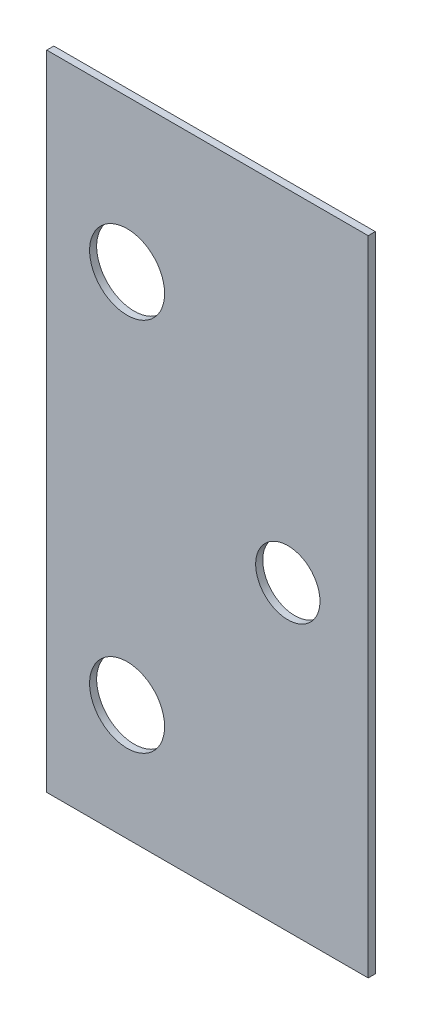
from build123d import *

# Parameters (mm, degrees)
SKETCH1_W           = 38.1
SKETCH1_H           = 76.2
BOSS_EXTRUDE1_DEPTH = 0.8382
SKETCH2_R           = 3.81
SKETCH2_R_2         = 4.445
CUT_EXTRUDE1_DEPTH  = 47.225254911


with BuildPart() as part:
    # Sketch1 → Boss-Extrude1 (new body)
    with BuildSketch(Plane.XY):
        with Locations((-3.690013682, 2.136344145)):
            Rectangle(SKETCH1_W, SKETCH1_H)
    extrude(amount=BOSS_EXTRUDE1_DEPTH)

    # Sketch2 → Cut-Extrude1 (cut, through all)
    with BuildSketch(Plane.XY.offset(0.8382)):
        with Locations((5.834986318, -0.147316624)):
            Circle(SKETCH2_R)
        with Locations((-13.215013682, 22.225)):
            Circle(SKETCH2_R_2)
        with Locations((-13.215013682, -22.225)):
            Circle(SKETCH2_R_2)
    extrude(amount=-CUT_EXTRUDE1_DEPTH, mode=Mode.SUBTRACT)


solid = part.part
